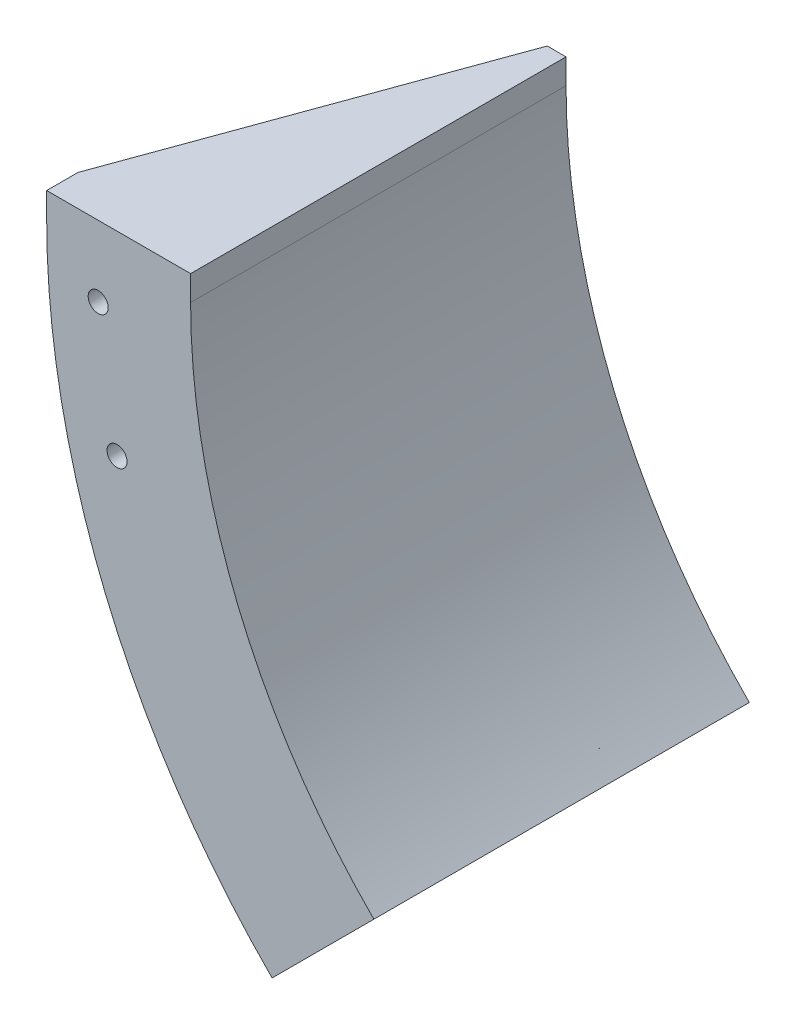
from build123d import *

# Parameters (mm, degrees)
EXTRUDE_1_DEPTH     = 60
EXTRUDE_START       = -5
EXTRUDE_2_DEPTH     = 5
SKETCH_4_R          = 1.6
CUT_EXTRUDE_1_DEPTH = 161.369884954
EXTRUDE_3_DEPTH     = 4
EXTRUDE_4_DEPTH     = 4


with BuildPart() as part:
    # 草图1 → 凸台-拉伸1 (new body)
    with BuildSketch(Plane.XY):
        with BuildLine():
            Line((-100, 0), (-103, 0))
            ThreePointArc((-103, 0), (-95.159591849, -39.416393534), (-72.831998462, -72.831998462))
            Line((-72.831998462, -72.831998462), (-70.710678119, -70.710678119))
            ThreePointArc((-70.710678119, -70.710678119), (-92.387953251, -38.268343237), (-100, 0))
        make_face()
    extrude(amount=EXTRUDE_1_DEPTH)

    # 草图2 → 凸台-拉伸2 (add)
    with BuildSketch(Plane.XY.offset(60).offset(EXTRUDE_START)):
        with BuildLine():
            Line((-103, 0), (-123, 0))
            ThreePointArc((-123, 0), (-113.637182499, -47.070062181), (-86.974134086, -86.974134086))
            Line((-86.974134086, -86.974134086), (-72.831998462, -72.831998462))
            ThreePointArc((-72.831998462, -72.831998462), (-95.159591849, -39.416393534), (-103, 0))
        make_face()
    extrude(amount=EXTRUDE_2_DEPTH)

    # 草图4 → 切除-拉伸1 (cut, through all)
    with BuildSketch(Plane(origin=(0, 0, 55), x_dir=(-1, 0, 0), z_dir=(0, 0, -1))):
        with Locations((111.754632886, -27.127514233)):
            Circle(SKETCH_4_R)
        with Locations((114.767472313, -7.30939799)):
            Circle(SKETCH_4_R)
    extrude(amount=-CUT_EXTRUDE_1_DEPTH, mode=Mode.SUBTRACT)

    # 草图7 → 凸台-拉伸4 (add)
    with BuildSketch(Plane(origin=(0, 0, 0), x_dir=(1, 0, 0), z_dir=(0, 1, 0))):
        Polygon((-103, 0), (-123, -55), (-123, -60), (-100, -60), (-100, 0), align=None)
    extrude(amount=EXTRUDE_4_DEPTH)


with BuildPart() as body_2:
    # 草图6 → 凸台-拉伸3 (new body)
    with BuildSketch(Plane(origin=(0, 0, 0), x_dir=(0, 0, -1), z_dir=(0.7071067811865477, -0.7071067811865475, 0))):
        Polygon((-55, -123), (-55, -103), (-55, -100), (0, -100), (0, -103), align=None)
    extrude(amount=-EXTRUDE_3_DEPTH)


solid = Compound([part.part, body_2.part])
